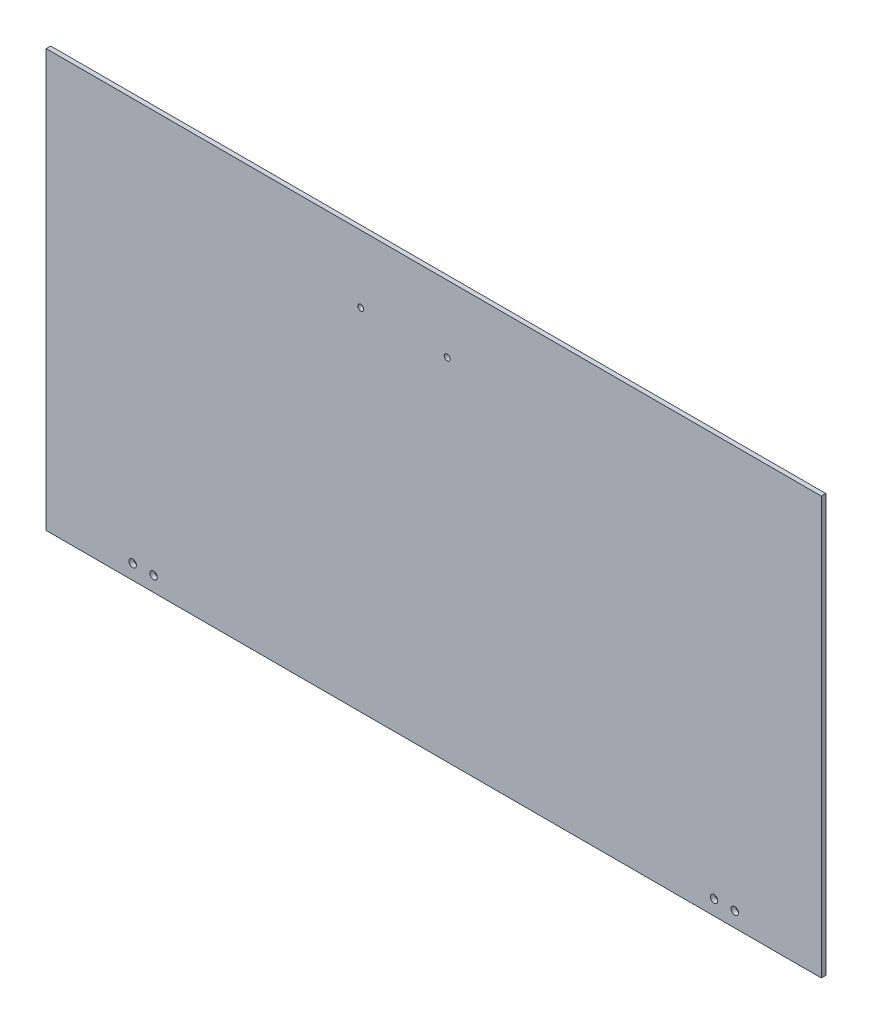
from build123d import *

# Parameters (mm, degrees)
SKETCH1_W             = 520
SKETCH1_H             = 280
BOSS_EXTRUDE1_DEPTH   = 3
F_5_0MM_DOWEL_HOLE1_D = 5
F_4_0MM_DOWEL_HOLE1_D = 4


with BuildPart() as part:
    # Sketch1 → Boss-Extrude1 (new body)
    with BuildSketch(Plane.XY):
        with Locations((260, 140)):
            Rectangle(SKETCH1_W, SKETCH1_H)
    extrude(amount=BOSS_EXTRUDE1_DEPTH)

    # Ø5.0mm Dowel Hole1 (through all)
    with Locations(Plane.XY.offset(3)):
        with Locations((461.999997675, 10.000001609), (447.999997675, 10.000001609), (71.999997675, 10.000001609), (57.999997675, 10.000001609)):
            Hole(F_5_0MM_DOWEL_HOLE1_D / 2)

    # Ø4.0mm Dowel Hole1 (through all)
    with Locations(Plane(origin=(0, 0, 0), x_dir=(-1, 0, 0), z_dir=(0, 0, -1))):
        with Locations((-269, 235), (-211, 235)):
            Hole(F_4_0MM_DOWEL_HOLE1_D / 2)


solid = part.part
